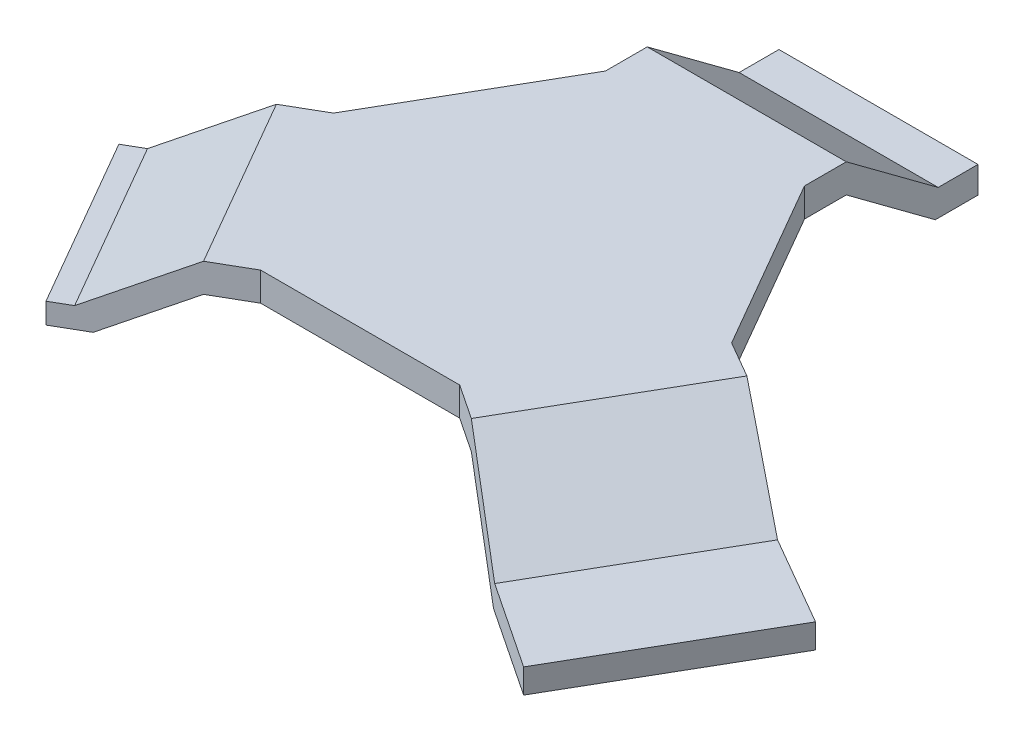
from build123d import *

# Parameters (mm, degrees)
BOSS_EXTRUDE1_DEPTH = 10
BOSS_EXTRUDE3_DEPTH = 69.34963783
BOSS_EXTRUDE4_DEPTH = 69.34963783
BOSS_EXTRUDE5_REACH = 181.774


with BuildPart() as part:
    # Sketch2 → Boss-Extrude1 (new body)
    with BuildSketch(Plane(origin=(0, 0, 0), x_dir=(1, 0, 0), z_dir=(0, 1, 0))):
        Polygon((-34.674818915, 60.058548104), (-34.674818915, 74.628755779), (34.674818915, 74.628755779), (34.674818915, 60.058548104), (69.34963783, 0), (81.964725461, -7.290440025), (46.802147984, -68.134366411), (34.674818915, -60.058548104), (-34.674818915, -60.058548104), (-47.2929889, -67.343651941), (-81.967807815, -7.285103837), (-69.34963783, 0), align=None)
    extrude(amount=BOSS_EXTRUDE1_DEPTH)

    # Sketch5 → Boss-Extrude3 (add)
    with BuildSketch(Plane(origin=(17.337409458, 0, 30.029274052), x_dir=(0.8660254037844373, 0, -0.5000000000000024), z_dir=(0.5000000000000024, 0, 0.8660254037844373))):
        Polygon((-74.628755779, 10), (-107.500686605, -9.402116298), (-114.804327341, -9.402116298), (-114.804327341, -16.610041857), (-102.770229552, -16.610041857), (-74.628755779, 0), align=None)
    extrude(amount=-BOSS_EXTRUDE3_DEPTH)

    # Sketch7 → Boss-Extrude4 (add)
    with BuildSketch(Plane.ZY.offset(34.674818915)):
        Polygon((-74.628755779, 10), (-106.637571533, -13.734668021), (-120.515633105, -13.734668021), (-120.515633105, -23.002237989), (-105.649808909, -23.002237989), (-74.628755779, 0), align=None)
    extrude(amount=-BOSS_EXTRUDE4_DEPTH)

    # Boss-Extrude5: up to this plane
    boss_extrude5_end = Plane(origin=(46.802147984, 10, 68.134366411), z_dir=(0.5542692655665835, 0, -0.8323374203099847))
    # Sketch8 → Boss-Extrude5 (add, up to the surface)
    with BuildSketch(Plane(origin=(17.362817345, 0, -30.043928978), x_dir=(-0.8658138519612032, 0, -0.500366239620644), z_dir=(0.500366239620644, 0, -0.8658138519612032)), mode=Mode.PRIVATE) as boss_extrude5_sk1:
        Polygon((-74.614084737, 10), (-103.818325668, -19.516175566), (-140.022146245, -19.516175566), (-140.022146245, -28.029543005), (-102.347404227, -28.029543005), (-74.614084737, 0), align=None)
    boss_extrude5_tool1 = split(extrude(boss_extrude5_sk1.sketch, amount=-BOSS_EXTRUDE5_REACH, mode=Mode.PRIVATE), bisect_by=boss_extrude5_end, keep=Keep.BOTH, mode=Mode.PRIVATE)
    add(boss_extrude5_tool1.solids().sort_by_distance((94.141781, -5.290236, 14.327735))[0])


solid = part.part
